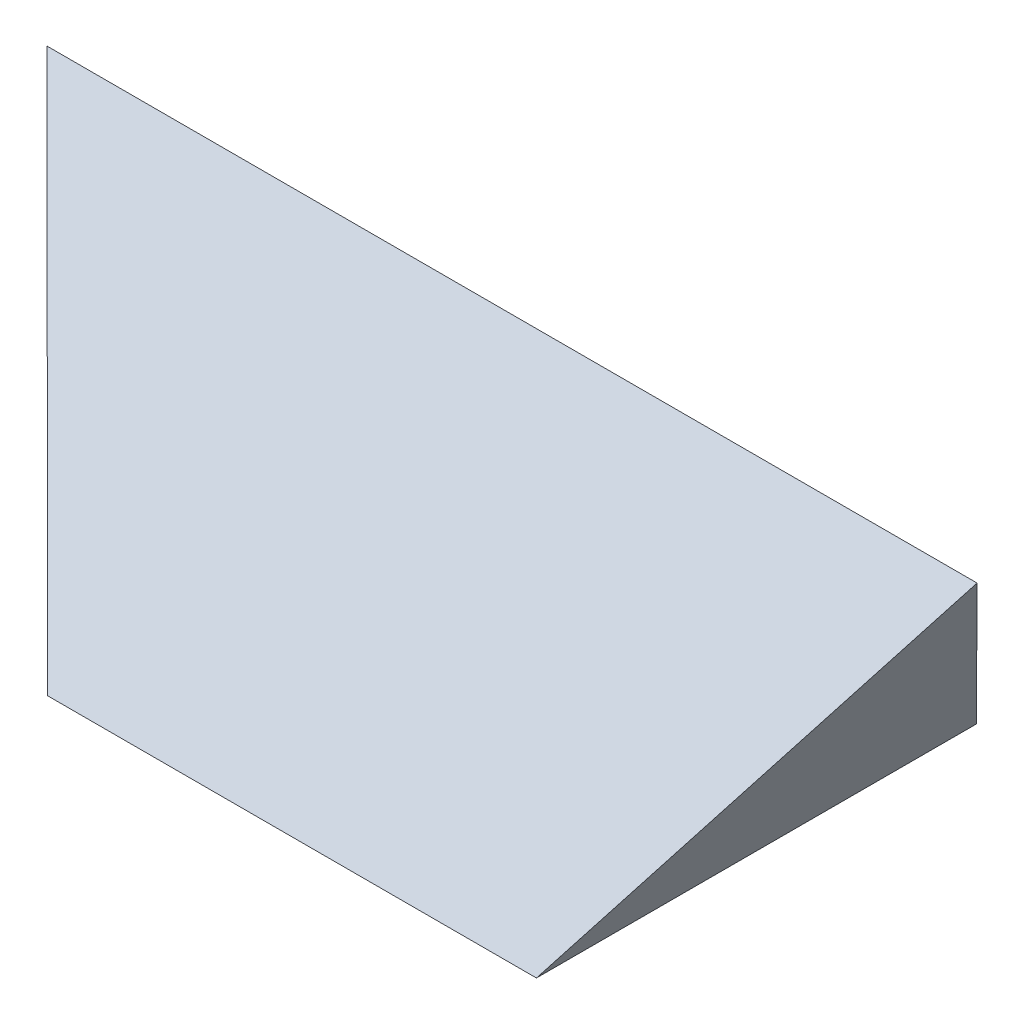
from build123d import *

# Parameters (mm, degrees)
BOSS_EXTRUDE2_DEPTH     = 27
CUT_EXTRUDE4_DEPTH      = 37
CUT_EXTRUDE4_DEPTH_BACK = 37
CUT_EXTRUDE5_DEPTH      = 37
CUT_EXTRUDE5_DEPTH_BACK = 37


with BuildPart() as part:
    # Sketch1 → Boss-Extrude2 (new body)
    with BuildSketch(Plane.XY):
        Polygon((15, 0), (-15, 0), (-28.5432741, 21.013798482), (28.5432741, 21.013798482), align=None)
    extrude(amount=BOSS_EXTRUDE2_DEPTH)

    # Sketch3 → Cut-Extrude4 (cut, two sides: drawn at the far end of the back side and taken through both)
    with BuildSketch(Plane(origin=(0, 0, 0), x_dir=(0, 0, -1), z_dir=(1, 0, 0)).offset(-CUT_EXTRUDE4_DEPTH_BACK)):
        Polygon((-13.5, 21.013798482), (0, 0), (0, 21.013798482), align=None)
    extrude(amount=CUT_EXTRUDE4_DEPTH + CUT_EXTRUDE4_DEPTH_BACK, mode=Mode.SUBTRACT)

    # Sketch4 → Cut-Extrude5 (cut, two sides: drawn at the far end of the back side and taken through both)
    with BuildSketch(Plane(origin=(0, 0, 0), x_dir=(0, 0, -1), z_dir=(1, 0, 0)).offset(-CUT_EXTRUDE5_DEPTH_BACK)):
        Polygon((-13.5, 21.013798482), (-27, 0), (-27, 21.013798482), align=None)
    extrude(amount=CUT_EXTRUDE5_DEPTH + CUT_EXTRUDE5_DEPTH_BACK, mode=Mode.SUBTRACT)


solid = part.part
